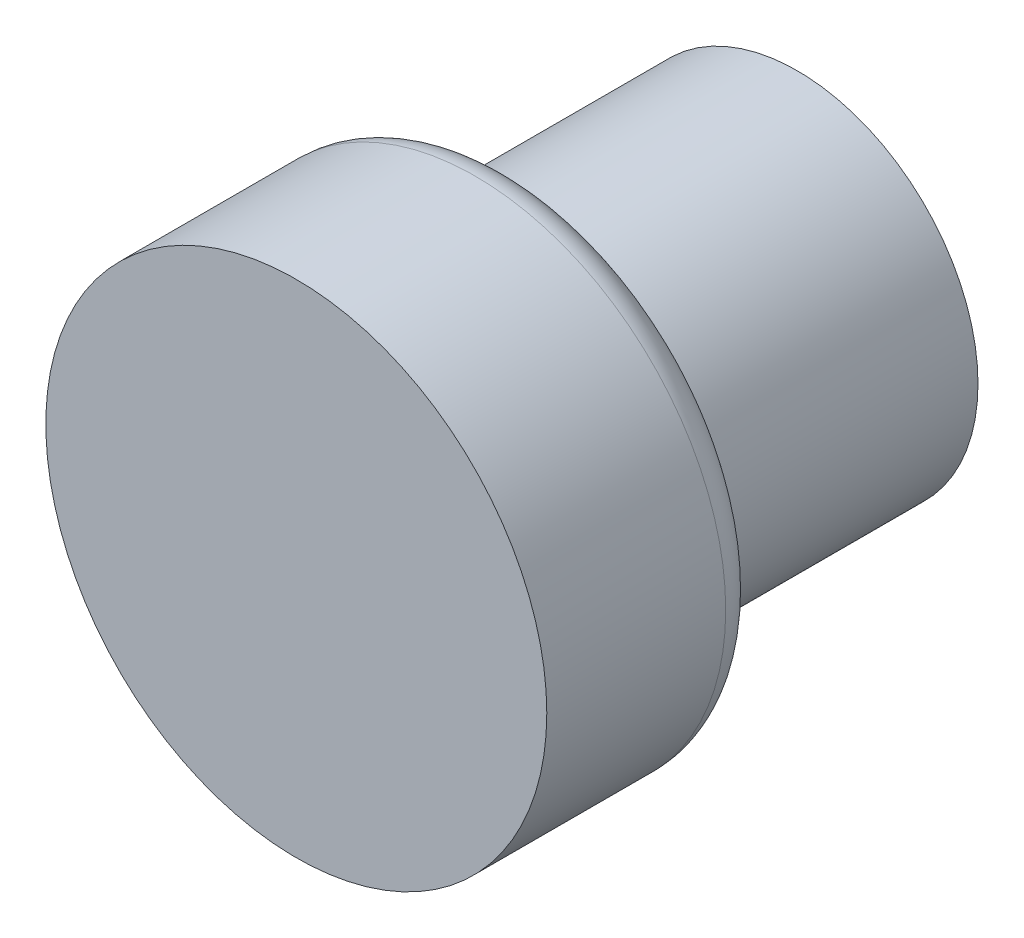
from build123d import *

# Parameters (mm, degrees)
SKETCH1_R           = 2.525
BOSS_EXTRUDE1_DEPTH = 4
SKETCH2_R           = 3.5
BOSS_EXTRUDE2_DEPTH = 3
FILLET1_R           = 0.5


with BuildPart() as part:
    # Sketch1 → Boss-Extrude1 (new body)
    with BuildSketch(Plane.XY):
        Circle(SKETCH1_R)
    extrude(amount=BOSS_EXTRUDE1_DEPTH)

    # Sketch2 → Boss-Extrude2 (add)
    with BuildSketch(Plane.XY.offset(4)):
        Circle(SKETCH2_R)
    extrude(amount=BOSS_EXTRUDE2_DEPTH)

    # Fillet1
    fillet1_edges = [part.edges().sort_by_distance(p)[0] for p in [
        (-3.5, 0, 4),
    ]]
    fillet(fillet1_edges, radius=FILLET1_R)


solid = part.part
